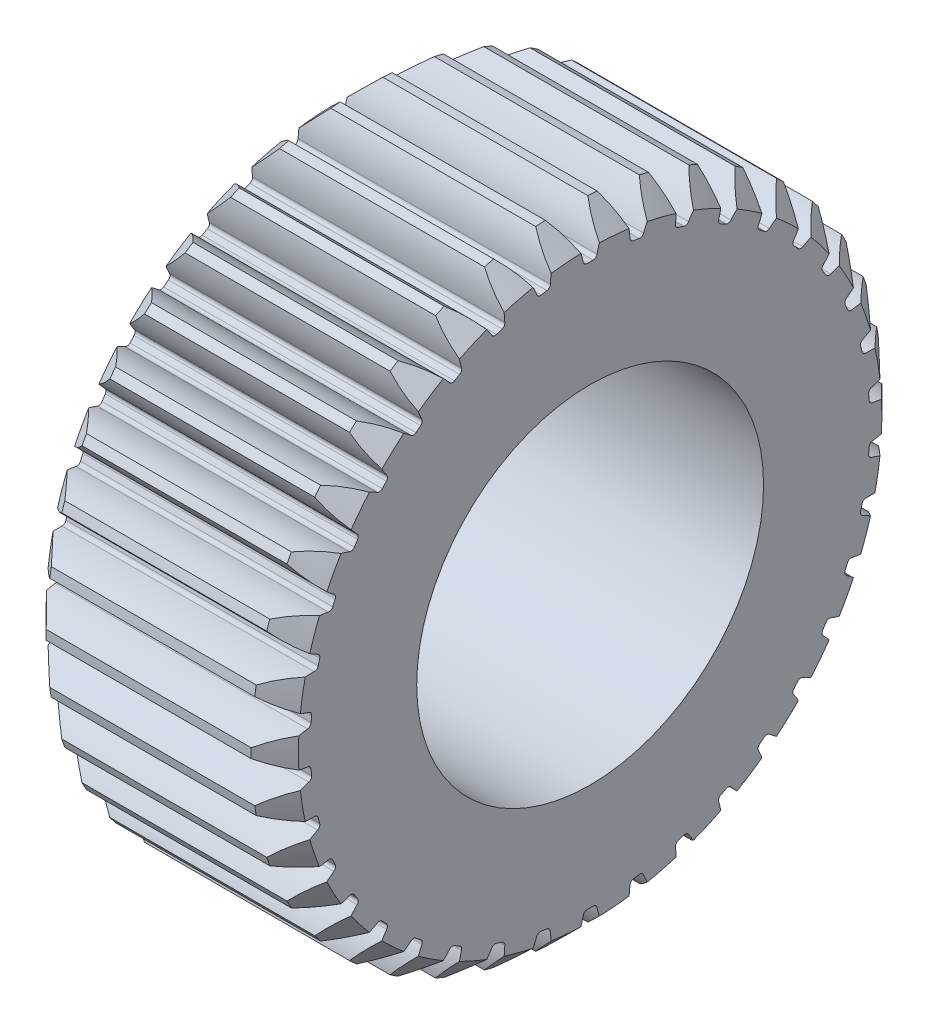
from build123d import *

# Parameters (mm, degrees)
ENL_V_MAT_EXTRU_1_DEPTH      = 33.496153619
R_P_TITION_CIRCULAIRE1_COUNT = 38
R_P_TITION_CIRCULAIRE1_ANGLE = 350.526315789


with BuildPart() as part:
    # Esquisse1 → Base-Révolution (revolve)
    with BuildSketch(Plane.XY):
        Polygon((-8, 11), (-8, 18.5), (-6.5, 20), (6.5, 20), (8, 18.5), (8, 11), align=None)
    revolve(axis=Axis((-22.699345692, 0, 0), (1, 0, 0)))

    # Esquisse2 → Enlèv. mat.-Extru.1 (cut, through all)
    with BuildSketch(Plane(origin=(8, 0, 0), x_dir=(0, 0, -1), z_dir=(1, 0, 0))):
        with BuildLine():
            ThreePointArc((-0.438177626, 17.941079919), (-0.78446372, 18.997986532), (-1.352425748, 19.954221223))
            ThreePointArc((-1.352425748, 19.954221223), (0, 20), (1.352425748, 19.954221223))
            ThreePointArc((1.352425748, 19.954221223), (0.78446372, 18.997986532), (0.438177626, 17.941079919))
            ThreePointArc((0.438177626, 17.941079919), (0.3500381, 17.797513267), (0.190823255, 17.742462449))
            ThreePointArc((0.190823255, 17.742462449), (0, 17.743488588), (-0.190823255, 17.742462449))
            ThreePointArc((-0.190823255, 17.742462449), (-0.3500381, 17.797513267), (-0.438177626, 17.941079919))
        make_face()
    enl_v_mat_extru_1 = extrude(amount=-ENL_V_MAT_EXTRU_1_DEPTH, mode=Mode.SUBTRACT)

    # Répétition circulaire1: Enlèv. mat.-Extru.1 ×38 about axis
    r_p_tition_circulaire1_axis = Axis((0, 0, 0), (1, 0, 0))
    for i in range(1, R_P_TITION_CIRCULAIRE1_COUNT):
        add(enl_v_mat_extru_1.rotate(r_p_tition_circulaire1_axis, i * R_P_TITION_CIRCULAIRE1_ANGLE / (R_P_TITION_CIRCULAIRE1_COUNT - 1)), mode=Mode.SUBTRACT)


solid = part.part
